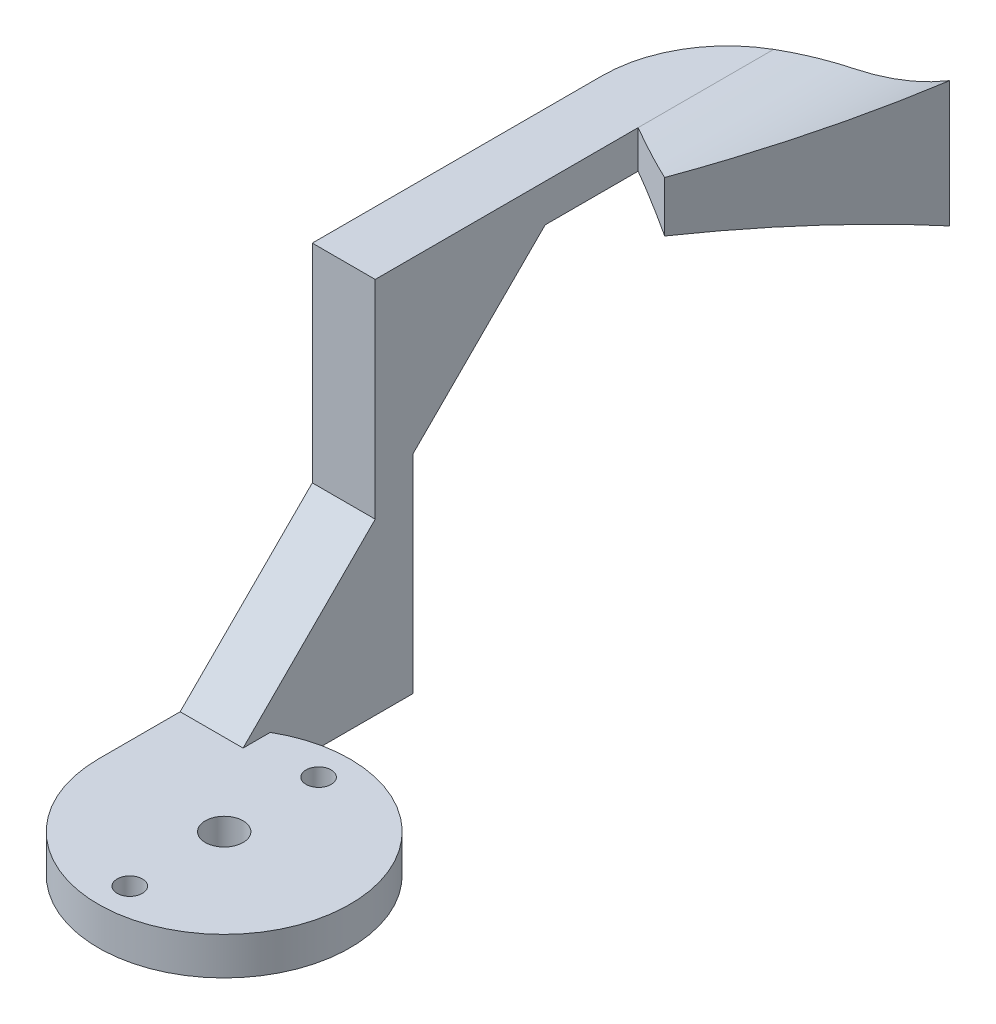
from build123d import *

# Parameters (mm, degrees)
SKETCH1_R           = 1.5
BOSS_EXTRUDE1_DEPTH = 3
SKETCH2_W           = 1.5
SKETCH2_H           = 3
BOSS_EXTRUDE2_DEPTH = 5
BOSS_EXTRUDE3_DEPTH = 3
BOSS_EXTRUDE4_START = -1.5
BOSS_EXTRUDE4_DEPTH = 5
SKETCH6_OUTSIDE_W   = 36.314
SKETCH6_OUTSIDE_H   = 49.814
CUT_EXTRUDE2_DEPTH  = 57.984647055
SKETCH7_R           = 1
CUT_EXTRUDE3_DEPTH  = 62.010245195


with BuildPart() as part:
    # Sketch1 → Boss-Extrude1 (new body)
    with BuildSketch(Plane(origin=(0, 0, 0), x_dir=(1, 0, 0), z_dir=(0, 1, 0))):
        with BuildLine():
            Line((-10, 0), (-10, 20))
            Line((-10, 20), (-5, 20))
            Line((-5, 20), (-5, 8.660254038))
            ThreePointArc((-5, 8.660254038), (8.660254038, -5), (-10, 0))
        make_face()
        with Locations(Location((0, 0, 0), (0, 0, 270))):
            Circle(SKETCH1_R, mode=Mode.SUBTRACT)
    extrude(amount=BOSS_EXTRUDE1_DEPTH)

    # Sketch2 → Boss-Extrude2 (add)
    with BuildSketch(Plane.ZY.offset(10)):
        with Locations((-19.25, 1.5)):
            Rectangle(SKETCH2_W, SKETCH2_H)
        Polygon((-18.5, 0), (-17, 0), (-6.5, 0), (-6.5, 3), (-18.5, 3), align=None)
        Polygon((-18.5, 30), (-18.5, 3), (-6.5, 3), (-17, 13.5), (-17, 30), align=None)
        Polygon((-20, 3), (-18.5, 3), (-18.5, 30), (-20, 30), (-30, 30), (-30, 27), (-30.5, 27), (-20, 16.5), align=None)
    extrude(amount=-BOSS_EXTRUDE2_DEPTH)

    # Sketch4 → Boss-Extrude3 (add)
    with BuildSketch(Plane(origin=(0, 30, 0), x_dir=(1, 0, 0), z_dir=(0, 1, 0))):
        with BuildLine():
            Line((-5, 17), (-10, 17))
            Line((-10, 17), (-10, 40))
            ThreePointArc((-10, 40), (-7.071067812, 47.071067812), (0, 50))
            Line((0, 50), (0, 35))
            Line((0, 35), (-5, 37.886751346))
            Line((-5, 37.886751346), (-5, 30))
            Line((-5, 30), (-5, 17))
        make_face()
    extrude(amount=-BOSS_EXTRUDE3_DEPTH)

    # Sketch5 → Boss-Extrude4 (add, symmetric)
    with BuildSketch(Plane(origin=(0, 30, 0), x_dir=(1, 0, 0), z_dir=(0, 1, 0)).offset(BOSS_EXTRUDE4_START)):
        with BuildLine():
            Line((-5, 37.886751346), (-10, 37.886751346))
            Line((-10, 37.886751346), (-10, 40))
            ThreePointArc((-10, 40), (-7.071067812, 47.071067812), (0, 50))
            Line((0, 50), (7.642881742, 50))
            Line((7.642881742, 50), (0, 35))
            Line((0, 35), (-5, 37.886751346))
        make_face()
    extrude(amount=BOSS_EXTRUDE4_DEPTH, both=True)

    # Sketch6 outside → Cut-Extrude2 (cut, through all)
    with BuildSketch(Plane.XY.offset(-35)):
        with Locations((0, 16.75)):
            Rectangle(SKETCH6_OUTSIDE_W, SKETCH6_OUTSIDE_H)
        with BuildLine():
            Line((-10, 30), (-5, 30))
            ThreePointArc((-5, 30), (1.559200766, 30.891151362), (7.642881742, 33.5))
            Line((7.642881742, 33.5), (7.642881742, 23.5))
            ThreePointArc((7.642881742, 23.5), (1.559200766, 26.108848638), (-5, 27))
            Line((-5, 27), (-10, 27))
            Line((-10, 27), (-10, 30))
        make_face(mode=Mode.SUBTRACT)
    extrude(amount=-CUT_EXTRUDE2_DEPTH, mode=Mode.SUBTRACT)

    # Sketch7 → Cut-Extrude3 (cut, through all)
    with BuildSketch(Plane.XZ):
        with Locations(Location((0, -7.5, 0), (0, 0, 270))):
            Circle(SKETCH7_R)
        with Locations(Location((0, 7.5, 0), (0, 0, 270))):
            Circle(SKETCH7_R)
    extrude(amount=-CUT_EXTRUDE3_DEPTH, mode=Mode.SUBTRACT)


solid = part.part
